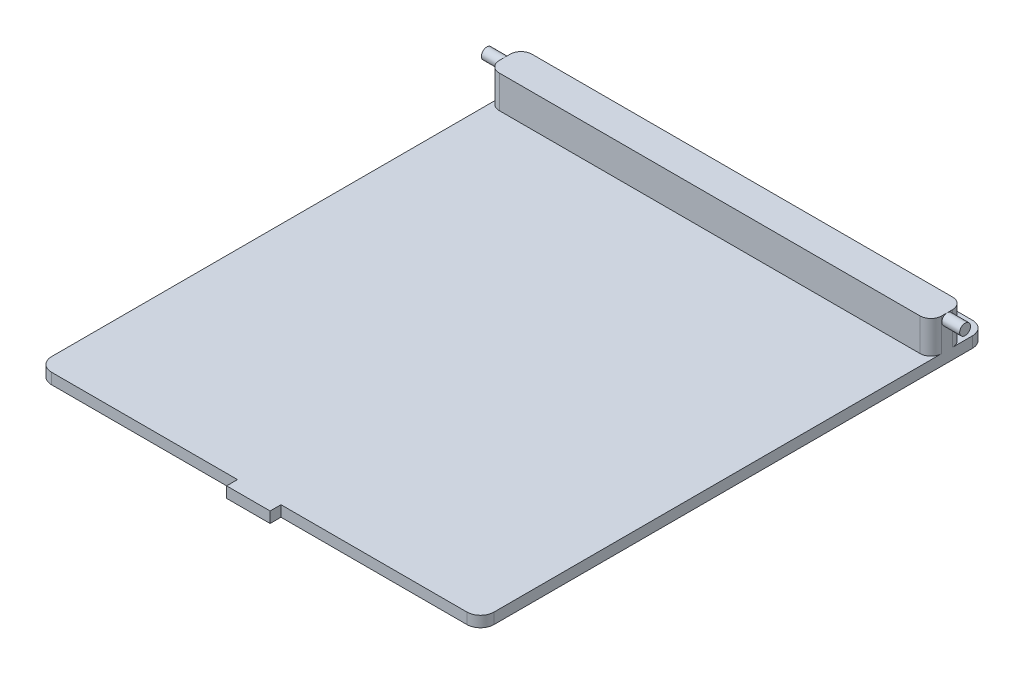
from build123d import *

# Parameters (mm, degrees)
SKETCH1_W           = 81.4
SKETCH1_H           = 6
BOSS_EXTRUDE1_DEPTH = 3
FILLET1_R           = 2
SKETCH2_R           = 1
BOSS_EXTRUDE2_DEPTH = 44
SKETCH3_W           = 81.4
SKETCH3_H           = 93
BOSS_EXTRUDE3_DEPTH = 2
FILLET2_R           = 2.5
SKETCH4_W           = 8
SKETCH4_H           = 4
BOSS_EXTRUDE4_DEPTH = 2


with BuildPart() as part:
    # Sketch1 → Boss-Extrude1 (new, symmetric)
    with BuildSketch(Plane(origin=(0, 0, 0), x_dir=(1, 0, 0), z_dir=(0, 1, 0))):
        Rectangle(SKETCH1_W, SKETCH1_H)
    extrude(amount=BOSS_EXTRUDE1_DEPTH, both=True)

    # Fillet1
    fillet1_edges = [part.edges().sort_by_distance(p)[0] for p in [
        (-40.7, 0, -3),
        (40.7, 0, -3),
        (40.7, 0, 3),
        (-40.7, 0, 3),
    ]]
    fillet(fillet1_edges, radius=FILLET1_R)

    # Sketch2 → Boss-Extrude2 (add, symmetric)
    with BuildSketch(Plane(origin=(0, 0, 0), x_dir=(0, 0, -1), z_dir=(1, 0, 0))):
        with Locations((0, 2)):
            Circle(SKETCH2_R)
    extrude(amount=BOSS_EXTRUDE2_DEPTH, both=True)

    # Sketch3 → Boss-Extrude3 (add)
    with BuildSketch(Plane.XZ.offset(3)):
        with Locations((0, 39.36)):
            Rectangle(SKETCH3_W, SKETCH3_H)
    extrude(amount=BOSS_EXTRUDE3_DEPTH)

    # Fillet2
    fillet2_edges = [part.edges().sort_by_distance(p)[0] for p in [
        (40.7, -4, -7.14),
        (40.7, -4, 85.86),
        (-40.7, -4, 85.86),
        (-40.7, -4, -7.14),
    ]]
    fillet(fillet2_edges, radius=FILLET2_R)

    # Sketch4 → Boss-Extrude4 (add)
    with BuildSketch(Plane.XZ.offset(5)):
        with Locations((0, 85.86)):
            Rectangle(SKETCH4_W, SKETCH4_H)
    extrude(amount=-BOSS_EXTRUDE4_DEPTH)


solid = part.part
